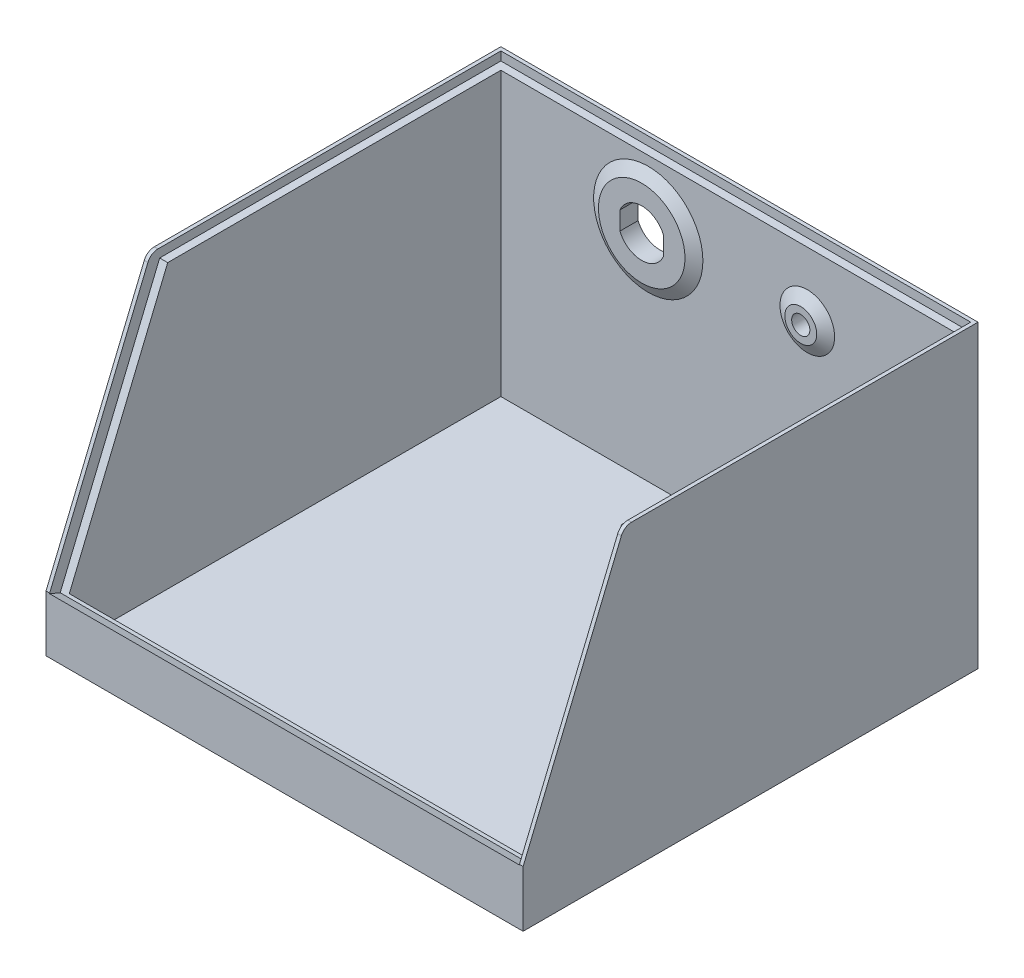
from build123d import *

# Parameters (mm, degrees)
SKETCH1_W                     = 131
SKETCH1_H                     = 124.9
SKETCH1_W_2                   = 124.6
SKETCH1_H_2                   = 118.5
BOSS_EXTRUDE1_DEPTH           = 2.4
SKETCH1_3_W                   = 131
SKETCH1_3_H                   = 124.9
SKETCH1_3_W_2                 = 124.6
SKETCH1_3_H_2                 = 118.5
BOSS_EXTRUDE2_DEPTH           = 80
CUT_EXTRUDE1_DEPTH            = 197.769729517
CUT_EXTRUDE2_REACH            = 199.577
SKETCH3_W                     = 124.6
SKETCH3_H                     = 3.362002976
SKETCH4_W                     = 129
SKETCH4_H                     = 72.65
CUT_EXTRUDE3_DEPTH            = 3.2
SKETCH5_W                     = 129
SKETCH5_H                     = 96.155451154
CUT_EXTRUDE4_DEPTH            = 2.4
FILLET1_R                     = 3
SKETCH7_R                     = 15
BOSS_EXTRUDE3_DEPTH           = 1.8
BOSS_EXTRUDE3_DRAFT           = 60
SKETCH7_R_2                   = 7.5
BOSS_EXTRUDE3_PROFILE_2_DEPTH = 1.8
BOSS_EXTRUDE3_PROFILE_2_DRAFT = 60
SKETCH6_W                     = 11.9888
SKETCH6_H                     = 2.519598063
SKETCH6_R                     = 2.5
CUT_EXTRUDE6_DEPTH            = 196.787767749


with BuildPart() as part:
    # Sketch1 → Boss-Extrude1 (new body)
    # profile 1 of 2: a face of its own
    with BuildSketch(Plane(origin=(0, 0, 0), x_dir=(1, 0, 0), z_dir=(0, 1, 0))):
        with Locations((62.3, 60.66509434)):
            Rectangle(SKETCH1_W, SKETCH1_H)
        with Locations((62.3, 60.66509434)):
            Rectangle(SKETCH1_W_2, SKETCH1_H_2, mode=Mode.SUBTRACT)
    # profile 2 of 2: a face of its own
    with BuildSketch(Plane(origin=(0, 0, 0), x_dir=(1, 0, 0), z_dir=(0, 1, 0))):
        with Locations((62.3, 60.66509434)):
            Rectangle(SKETCH1_W_2, SKETCH1_H_2)
    extrude(amount=-BOSS_EXTRUDE1_DEPTH)

    # Sketch1<3> → Boss-Extrude2 (add)
    with BuildSketch(Plane(origin=(0, 0, 0), x_dir=(1, 0, 0), z_dir=(0, 1, 0))):
        with Locations((62.3, 60.66509434)):
            Rectangle(SKETCH1_3_W, SKETCH1_3_H)
        with Locations((62.3, 60.66509434)):
            Rectangle(SKETCH1_3_W_2, SKETCH1_3_H_2, mode=Mode.SUBTRACT)
    extrude(amount=BOSS_EXTRUDE2_DEPTH)

    # Sketch2 → Cut-Extrude1 (cut, through all)
    with BuildSketch(Plane(origin=(127.8, 0, 0), x_dir=(0, 0, -1), z_dir=(1, 0, 0))):
        Polygon((-1.78490566, 13.018733893), (25.959643186, 80), (-1.78490566, 80), align=None)
    extrude(amount=-CUT_EXTRUDE1_DEPTH, mode=Mode.SUBTRACT)

    # Sketch3 → Cut-Extrude2 (cut, up to next)
    with BuildSketch(Plane(origin=(0, 2.537608886, 6.126329787), x_dir=(1, 0, 0), z_dir=(0, 0.38268343236508395, 0.9238795325112892)), mode=Mode.PRIVATE) as cut_extrude2_sk1:
        with Locations((62.3, 18.025689446)):
            Rectangle(SKETCH3_W, SKETCH3_H)
    cut_extrude2_tool1 = extrude(cut_extrude2_sk1.sketch, amount=-CUT_EXTRUDE2_REACH, mode=Mode.PRIVATE) & part.part
    add(cut_extrude2_tool1.solids().sort_by_distance((62.3, 19.191174, -0.771803))[0], mode=Mode.SUBTRACT)

    # Sketch4 → Cut-Extrude3 (cut)
    with BuildSketch(Plane(origin=(0, 2.537608886, 6.126329787), x_dir=(1, 0, 0), z_dir=(0, 0.38268343236508423, 0.9238795325112892))):
        with Locations((62.3, 47.519687958)):
            Rectangle(SKETCH4_W, SKETCH4_H)
    extrude(amount=-CUT_EXTRUDE3_DEPTH, mode=Mode.SUBTRACT)

    # Sketch5 → Cut-Extrude4 (cut)
    with BuildSketch(Plane(origin=(0, 80, 0), x_dir=(1, 0, 0), z_dir=(0, 1, 0))):
        with Locations((62.3, 74.037368763)):
            Rectangle(SKETCH5_W, SKETCH5_H)
    extrude(amount=-CUT_EXTRUDE4_DEPTH, mode=Mode.SUBTRACT)

    # Fillet1
    fillet1_edges = [part.edges().sort_by_distance(p)[0] for p in [
        (-2.7, 80, -25.959643186),
        (127.3, 80, -25.959643186),
    ]]
    fillet(fillet1_edges, radius=FILLET1_R)


with BuildPart() as boss_extrude3_tool:
    # Sketch7 → Boss-Extrude3 (with draft: the straight prism first)
    with BuildSketch(Plane.XY.offset(-119.91509434)):
        with Locations((40.466666667, 60)):
            Circle(SKETCH7_R)
    extrude(amount=BOSS_EXTRUDE3_DEPTH)
    # Boss-Extrude3: the draft: its side faces are tilted about the plane it starts from
    boss_extrude3_sides = [boss_extrude3_tool.faces().sort_by_distance(p)[0] for p in [
        (25.466666667, 60, -119.01509434),
    ]]
    draft(boss_extrude3_sides, Plane.XY.offset(-119.91509434), BOSS_EXTRUDE3_DRAFT)


with BuildPart() as part_1:
    add(part.part)

    # Boss-Extrude3: add boss_extrude3_tool
    add(boss_extrude3_tool.part)


with BuildPart() as boss_extrude3_profile_2_tool:
    # Sketch7 → Boss-Extrude3 profile 2 (with draft: the straight prism first)
    with BuildSketch(Plane.XY.offset(-119.91509434)):
        with Locations((84.133333333, 60)):
            Circle(SKETCH7_R_2)
    extrude(amount=BOSS_EXTRUDE3_PROFILE_2_DEPTH)
    # Boss-Extrude3 profile 2: the draft: its side faces are tilted about the plane it starts from
    boss_extrude3_profile_2_sides = [boss_extrude3_profile_2_tool.faces().sort_by_distance(p)[0] for p in [
        (76.633333333, 60, -119.01509434),
    ]]
    draft(boss_extrude3_profile_2_sides, Plane.XY.offset(-119.91509434), BOSS_EXTRUDE3_PROFILE_2_DRAFT)


with BuildPart() as part_2:
    add(part_1.part)

    # Boss-Extrude3 profile 2: add boss_extrude3_profile_2_tool
    add(boss_extrude3_profile_2_tool.part)

    # Sketch6 → Cut-Extrude6 (cut, through all)
    with BuildSketch(Plane(origin=(0, 0, -123.11509434), x_dir=(-1, 0, 0), z_dir=(0, 0, -1))):
        with BuildLine():
            Line((-34.472266667, 57.480401937), (-46.461066667, 57.480401937))
            ThreePointArc((-46.461066667, 57.480401937), (-40.466666667, 53.4976), (-34.472266667, 57.480401937))
        make_face()
        with Locations((-40.466666667, 58.740200969)):
            Rectangle(SKETCH6_W, SKETCH6_H)
        with Locations((-40.466666667, 61.259799032)):
            Rectangle(SKETCH6_W, SKETCH6_H)
        with BuildLine():
            ThreePointArc((-34.472266667, 62.519598063), (-40.466666667, 66.5024), (-46.461066667, 62.519598063))
            Line((-46.461066667, 62.519598063), (-34.472266667, 62.519598063))
        make_face()
        with Locations((-84.133333333, 60)):
            Circle(SKETCH6_R)
    extrude(amount=-CUT_EXTRUDE6_DEPTH, mode=Mode.SUBTRACT)


solid = part_2.part
